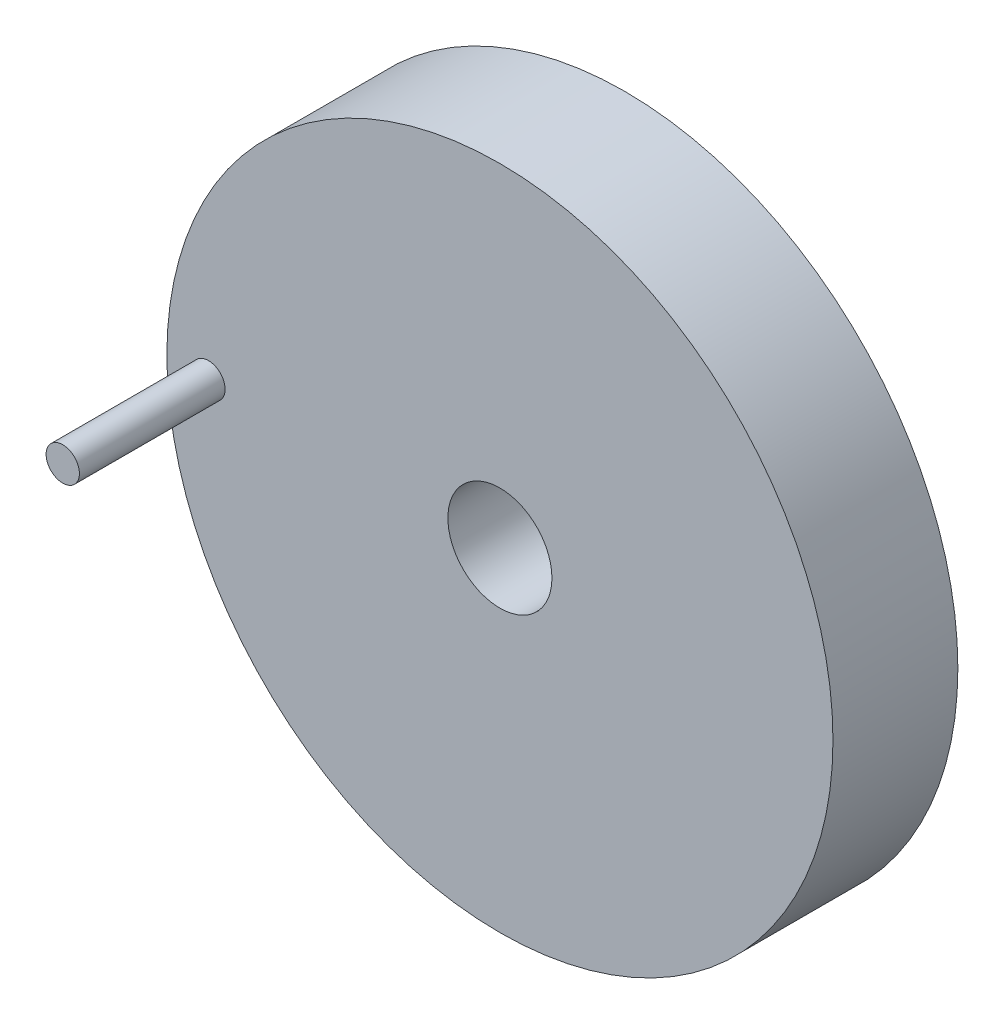
from build123d import *

# Parameters (mm, degrees)
SKETCH2_R           = 80
SKETCH2_R_2         = 12.5
BOSS_EXTRUDE1_DEPTH = 30
SKETCH3_R           = 4
BOSS_EXTRUDE2_DEPTH = 35


with BuildPart() as part:
    # Sketch2 → Boss-Extrude1 (new body)
    with BuildSketch(Plane.XY):
        Circle(SKETCH2_R)
        Circle(SKETCH2_R_2, mode=Mode.SUBTRACT)
    extrude(amount=-BOSS_EXTRUDE1_DEPTH)

    # Sketch3 → Boss-Extrude2 (add)
    with BuildSketch(Plane.XY):
        with Locations((-70, 0)):
            Circle(SKETCH3_R)
    extrude(amount=BOSS_EXTRUDE2_DEPTH)


solid = part.part
